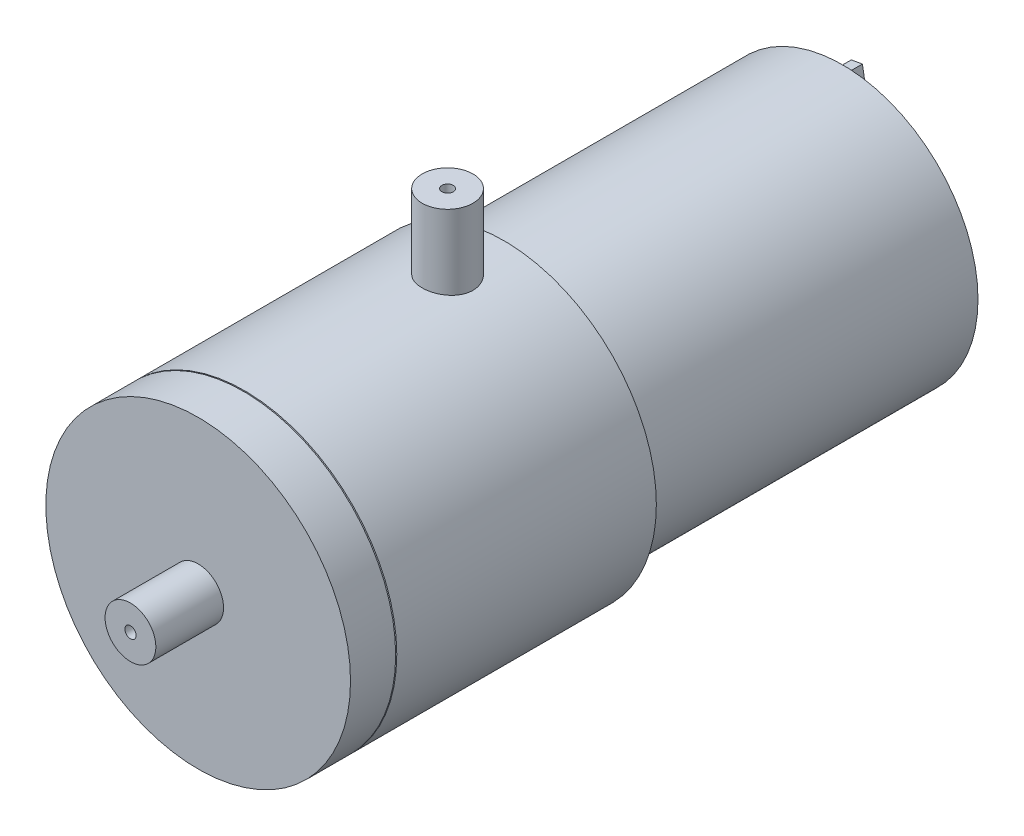
from build123d import *

# Parameters (mm, degrees)
SKETCH1_R           = 13.5
BOSS_EXTRUDE1_DEPTH = 23
SKETCH2_R           = 12.5
BOSS_EXTRUDE2_DEPTH = 0.1
SKETCH3_R           = 13.5
BOSS_EXTRUDE3_DEPTH = 4
SKETCH4_R           = 12
BOSS_EXTRUDE4_DEPTH = 30
SKETCH5_R           = 11.5
SKETCH5_R_2         = 3
CUT_EXTRUDE1_DEPTH  = 2
SKETCH6_R           = 2.25
SKETCH6_R_2         = 0.5
BOSS_EXTRUDE5_DEPTH = 6
SKETCH7_R           = 2.25
SKETCH7_R_2         = 0.5
BOSS_EXTRUDE6_DEPTH = 20
BOSS_EXTRUDE7_DEPTH = 5
SKETCH9_W           = 0.5
SKETCH9_H           = 0.5
CUT_EXTRUDE2_DEPTH  = 0.5


with BuildPart() as part:
    # Sketch1 → Boss-Extrude1 (new body)
    with BuildSketch(Plane.XY):
        Circle(SKETCH1_R)
    extrude(amount=BOSS_EXTRUDE1_DEPTH)

    # Sketch2 → Boss-Extrude2 (add)
    with BuildSketch(Plane.XY.offset(23)):
        Circle(SKETCH2_R)
    extrude(amount=BOSS_EXTRUDE2_DEPTH)

    # Sketch3 → Boss-Extrude3 (add)
    with BuildSketch(Plane.XY.offset(23.1)):
        Circle(SKETCH3_R)
    extrude(amount=BOSS_EXTRUDE3_DEPTH)

    # Sketch4 → Boss-Extrude4 (add)
    with BuildSketch(Plane(origin=(0, 0, 0), x_dir=(-1, 0, 0), z_dir=(0, 0, -1))):
        Circle(SKETCH4_R)
    extrude(amount=BOSS_EXTRUDE4_DEPTH)

    # Sketch5 → Cut-Extrude1 (cut)
    with BuildSketch(Plane(origin=(0, 0, -30), x_dir=(-1, 0, 0), z_dir=(0, 0, -1))):
        Circle(SKETCH5_R)
        Circle(SKETCH5_R_2, mode=Mode.SUBTRACT)
    extrude(amount=-CUT_EXTRUDE1_DEPTH, mode=Mode.SUBTRACT)

    # Sketch6 → Boss-Extrude5 (add)
    with BuildSketch(Plane.XY.offset(27.1)):
        Circle(SKETCH6_R)
        Circle(SKETCH6_R_2, mode=Mode.SUBTRACT)
    extrude(amount=BOSS_EXTRUDE5_DEPTH)

    # Sketch7 → Boss-Extrude6 (add)
    with BuildSketch(Plane(origin=(0, 0, 0), x_dir=(1, 0, 0), z_dir=(0, 1, 0))):
        with Locations((0, -5)):
            Circle(SKETCH7_R)
        with Locations((0, -5)):
            Circle(SKETCH7_R_2, mode=Mode.SUBTRACT)
    extrude(amount=BOSS_EXTRUDE6_DEPTH)

    # Sketch8 → Boss-Extrude7 (add)
    with BuildSketch(Plane(origin=(0, 0, -28), x_dir=(-1, 0, 0), z_dir=(0, 0, -1))):
        Polygon((0.549485189, 5.995670607), (1.2440779, 9.934901619), (2.228885653, 9.761253441), (1.534292943, 5.822022429), align=None)
        Polygon((-2.228885653, -9.761253441), (-1.2440779, -9.934901619), (-0.549485189, -5.995670607), (-1.534292943, -5.822022429), align=None)
    extrude(amount=BOSS_EXTRUDE7_DEPTH)

    # Sketch9 → Cut-Extrude2 (cut)
    with BuildSketch(Plane(origin=(0, 0, -30), x_dir=(-1, 0, 0), z_dir=(0, 0, -1))):
        Rectangle(SKETCH9_W, SKETCH9_H)
    extrude(amount=-CUT_EXTRUDE2_DEPTH, mode=Mode.SUBTRACT)


solid = part.part
